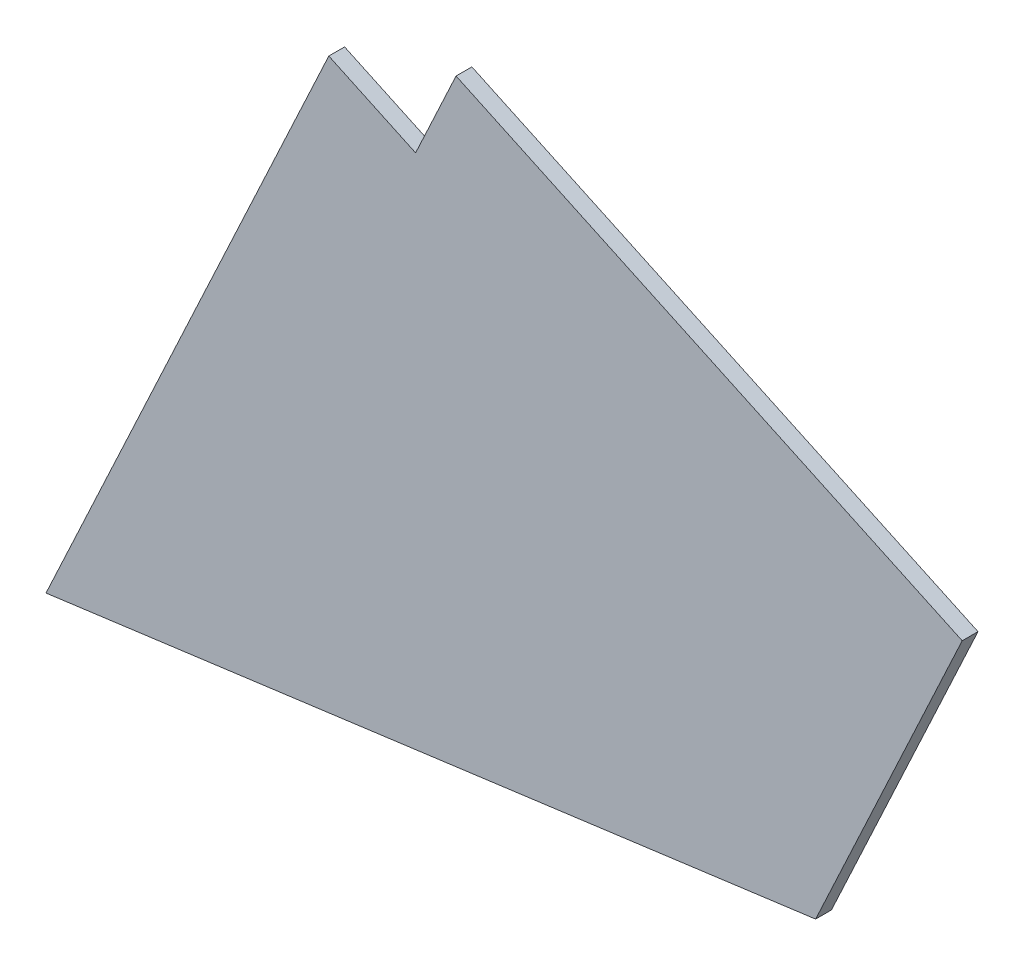
from build123d import *

# Parameters (mm, degrees)
BOSS_EXTRUDE1_DEPTH = 3.3


with BuildPart() as part:
    # Sketch1 → Boss-Extrude1 (new body)
    with BuildSketch(Plane.XY.offset(396.7)):
        Polygon((-344.846056087, -37.332052475), (-184.100284021, -15.936663151), (-153.484392838, 49.719327367), (-259.198908878, 99.014815774), (-267.651274112, 80.888660034), (-285.777429853, 89.341025269), align=None)
    extrude(amount=-BOSS_EXTRUDE1_DEPTH)


solid = part.part
